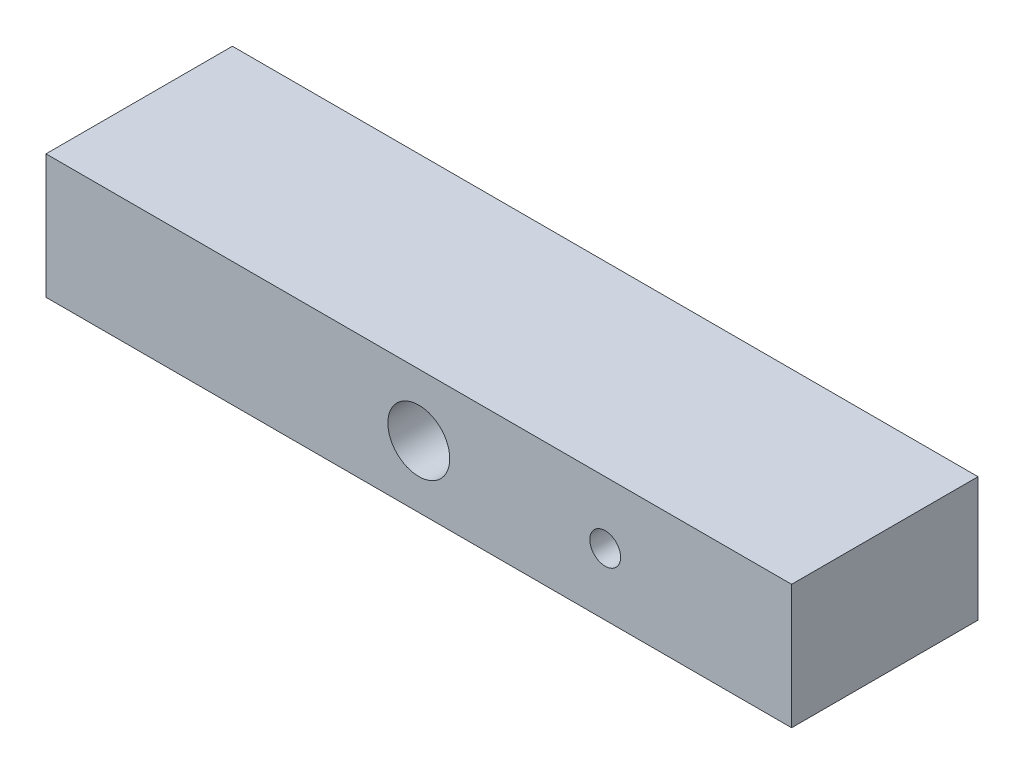
from build123d import *

# Parameters (mm, degrees)
SKETCH1_W           = 76.2
SKETCH1_H           = 12.7
BOSS_EXTRUDE1_DEPTH = 19.05
SKETCH2_R           = 3.1623
SKETCH2_R_2         = 1.5748
CUT_EXTRUDE1_DEPTH  = 19.05


with BuildPart() as part:
    # Sketch1 → Boss-Extrude1 (new body)
    with BuildSketch(Plane.XY):
        with Locations((-4.802521008, 6.35)):
            Rectangle(SKETCH1_W, SKETCH1_H)
    extrude(amount=BOSS_EXTRUDE1_DEPTH)

    # Sketch2 → Cut-Extrude1 (cut)
    with BuildSketch(Plane.XY.offset(19.05)):
        with Locations((-4.802521008, 6.35)):
            Circle(SKETCH2_R)
        with Locations((14.247478992, 6.35)):
            Circle(SKETCH2_R_2)
    extrude(amount=-CUT_EXTRUDE1_DEPTH, mode=Mode.SUBTRACT)


solid = part.part
